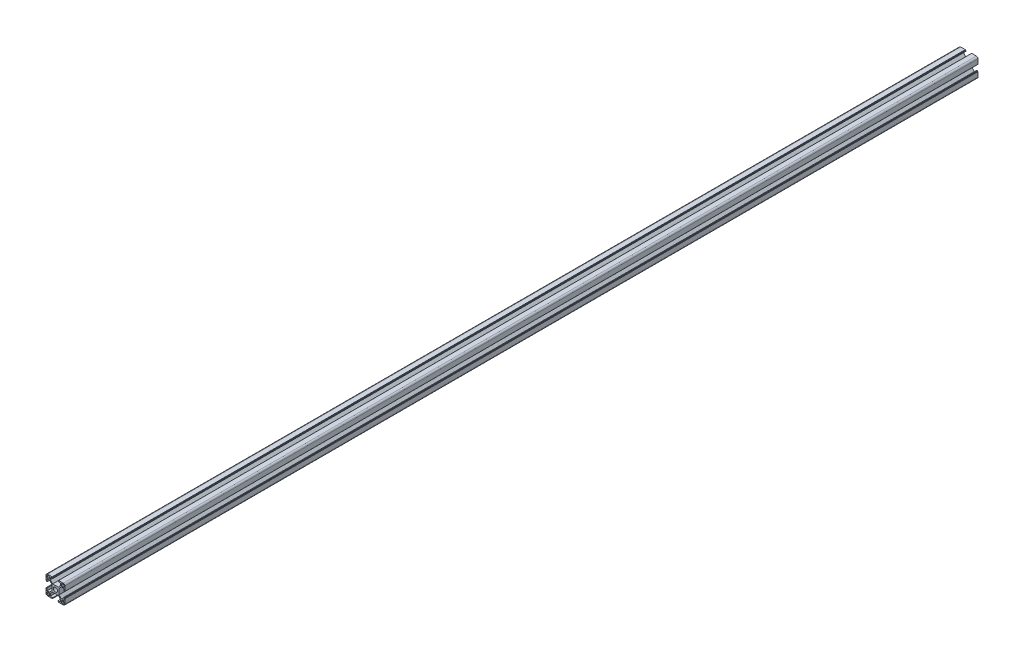
from build123d import *

# Parameters (mm, degrees)
SKETCH1_R      = 3.4
EXTRUDE1_DEPTH = 1450
EXTRUDE2_DEPTH = 1451.155164112


with BuildPart() as part:
    # Sketch1 → Extrude1 (new body)
    with BuildSketch(Plane.XY):
        with BuildLine():
            Line((-5.1, 14.2), (-5.1, 15))
            Line((-5.1, 15), (-12.5, 15))
            ThreePointArc((-12.5, 15), (-14.267766953, 14.267766953), (-15, 12.5))
            Line((-15, 12.5), (-15, 5.1))
            Line((-15, 5.1), (-14.2, 5.1))
            Line((-14.2, 5.1), (-14.2, 4.1))
            Line((-14.2, 4.1), (-13.2, 4.1))
            Line((-13.2, 4.1), (-13.2, 8.25))
            Line((-13.2, 8.25), (-9.522792206, 8.25))
            Line((-9.522792206, 8.25), (-5.7, 4.427207794))
            Line((-5.7, 4.427207794), (-5.7, -4.427207794))
            Line((-5.7, -4.427207794), (-9.522792206, -8.25))
            Line((-9.522792206, -8.25), (-13.2, -8.25))
            Line((-13.2, -8.25), (-13.2, -4.1))
            Line((-13.2, -4.1), (-14.2, -4.1))
            Line((-14.2, -4.1), (-14.2, -5.1))
            Line((-14.2, -5.1), (-15, -5.1))
            Line((-15, -5.1), (-15, -12.5))
            ThreePointArc((-15, -12.5), (-14.267766953, -14.267766953), (-12.5, -15))
            Line((-12.5, -15), (-5.1, -15))
            Line((-5.1, -15), (-5.1, -14.2))
            Line((-5.1, -14.2), (-4.1, -14.2))
            Line((-4.1, -14.2), (-4.1, -13.2))
            Line((-4.1, -13.2), (-8.25, -13.2))
            Line((-8.25, -13.2), (-8.25, -9.522792206))
            Line((-8.25, -9.522792206), (-4.427207794, -5.7))
            Line((-4.427207794, -5.7), (4.427207794, -5.7))
            Line((4.427207794, -5.7), (8.25, -9.522792206))
            Line((8.25, -9.522792206), (8.25, -13.2))
            Line((8.25, -13.2), (4.1, -13.2))
            Line((4.1, -13.2), (4.1, -14.2))
            Line((4.1, -14.2), (5.1, -14.2))
            Line((5.1, -14.2), (5.1, -15))
            Line((5.1, -15), (12.5, -15))
            ThreePointArc((12.5, -15), (14.267766953, -14.267766953), (15, -12.5))
            Line((15, -12.5), (15, -5.1))
            Line((15, -5.1), (14.2, -5.1))
            Line((14.2, -5.1), (14.2, -4.1))
            Line((14.2, -4.1), (13.2, -4.1))
            Line((13.2, -4.1), (13.2, -8.25))
            Line((13.2, -8.25), (9.522792206, -8.25))
            Line((9.522792206, -8.25), (5.7, -4.427207794))
            Line((5.7, -4.427207794), (5.7, 4.427207794))
            Line((5.7, 4.427207794), (9.522792206, 8.25))
            Line((9.522792206, 8.25), (13.2, 8.25))
            Line((13.2, 8.25), (13.2, 4.1))
            Line((13.2, 4.1), (14.2, 4.1))
            Line((14.2, 4.1), (14.2, 5.1))
            Line((14.2, 5.1), (15, 5.1))
            Line((15, 5.1), (15, 12.5))
            ThreePointArc((15, 12.5), (14.267766953, 14.267766953), (12.5, 15))
            Line((12.5, 15), (5.1, 15))
            Line((5.1, 15), (5.1, 14.2))
            Line((5.1, 14.2), (4.1, 14.2))
            Line((4.1, 14.2), (4.1, 13.2))
            Line((4.1, 13.2), (8.25, 13.2))
            Line((8.25, 13.2), (8.25, 9.522792206))
            Line((8.25, 9.522792206), (4.427207794, 5.7))
            Line((4.427207794, 5.7), (-4.427207794, 5.7))
            Line((-4.427207794, 5.7), (-8.25, 9.522792206))
            Line((-8.25, 9.522792206), (-8.25, 13.2))
            Line((-8.25, 13.2), (-4.1, 13.2))
            Line((-4.1, 13.2), (-4.1, 14.2))
            Line((-4.1, 14.2), (-5.1, 14.2))
        make_face()
        Circle(SKETCH1_R, mode=Mode.SUBTRACT)
    extrude(amount=EXTRUDE1_DEPTH)

    # Sketch2 → Extrude2 (cut, through all)
    with BuildSketch(Plane.XY.offset(1450)):
        with BuildLine():
            Line((13.7, 12.7), (13.7, 10.55))
            ThreePointArc((13.7, 10.55), (13.407106781, 9.842893219), (12.7, 9.55))
            Line((12.7, 9.55), (10.55, 9.55))
            ThreePointArc((10.55, 9.55), (9.842893219, 9.842893219), (9.55, 10.55))
            Line((9.55, 10.55), (9.55, 12.7))
            ThreePointArc((9.55, 12.7), (9.842893219, 13.407106781), (10.55, 13.7))
            Line((10.55, 13.7), (12.7, 13.7))
            ThreePointArc((12.7, 13.7), (13.407106781, 13.407106781), (13.7, 12.7))
        make_face()
        with BuildLine():
            Line((-12.7, 13.7), (-10.55, 13.7))
            ThreePointArc((-10.55, 13.7), (-9.842893219, 13.407106781), (-9.55, 12.7))
            Line((-9.55, 12.7), (-9.55, 10.55))
            ThreePointArc((-9.55, 10.55), (-9.842893219, 9.842893219), (-10.55, 9.55))
            Line((-10.55, 9.55), (-12.7, 9.55))
            ThreePointArc((-12.7, 9.55), (-13.407106781, 9.842893219), (-13.7, 10.55))
            Line((-13.7, 10.55), (-13.7, 12.7))
            ThreePointArc((-13.7, 12.7), (-13.407106781, 13.407106781), (-12.7, 13.7))
        make_face()
        with BuildLine():
            Line((12.7, -13.7), (10.55, -13.7))
            ThreePointArc((10.55, -13.7), (9.842893219, -13.407106781), (9.55, -12.7))
            Line((9.55, -12.7), (9.55, -10.55))
            ThreePointArc((9.55, -10.55), (9.842893219, -9.842893219), (10.55, -9.55))
            Line((10.55, -9.55), (12.7, -9.55))
            ThreePointArc((12.7, -9.55), (13.407106781, -9.842893219), (13.7, -10.55))
            Line((13.7, -10.55), (13.7, -12.7))
            ThreePointArc((13.7, -12.7), (13.407106781, -13.407106781), (12.7, -13.7))
        make_face()
        with BuildLine():
            Line((-13.7, -12.7), (-13.7, -10.55))
            ThreePointArc((-13.7, -10.55), (-13.407106781, -9.842893219), (-12.7, -9.55))
            Line((-12.7, -9.55), (-10.55, -9.55))
            ThreePointArc((-10.55, -9.55), (-9.842893219, -9.842893219), (-9.55, -10.55))
            Line((-9.55, -10.55), (-9.55, -12.7))
            ThreePointArc((-9.55, -12.7), (-9.842893219, -13.407106781), (-10.55, -13.7))
            Line((-10.55, -13.7), (-12.7, -13.7))
            ThreePointArc((-12.7, -13.7), (-13.407106781, -13.407106781), (-13.7, -12.7))
        make_face()
    extrude(amount=-EXTRUDE2_DEPTH, mode=Mode.SUBTRACT)


solid = part.part
